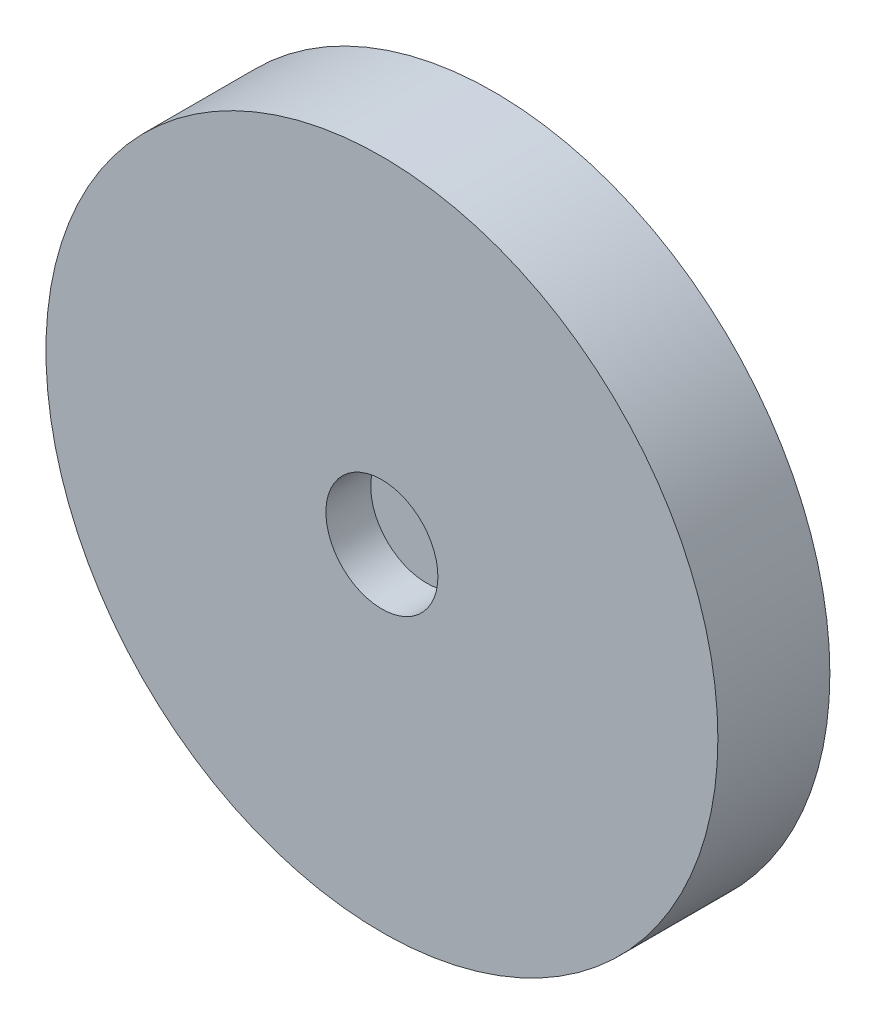
from build123d import *

# Parameters (mm, degrees)
ESQUISSE1_R             = 15
BOSS_EXTRU_1_DEPTH      = 5
ESQUISSE2_R             = 1
BOSS_EXTRU_2_DEPTH      = 3
ESQUISSE3_R             = 2.5
ENL_V_MAT_EXTRU_2_DEPTH = 2


with BuildPart() as part:
    # Esquisse1 → Boss.-Extru.1 (new body)
    with BuildSketch(Plane.XY):
        Circle(ESQUISSE1_R)
    extrude(amount=BOSS_EXTRU_1_DEPTH)

    # Esquisse2 → Boss.-Extru.2 (add)
    with BuildSketch(Plane(origin=(0, 0, 0), x_dir=(-1, 0, 0), z_dir=(0, 0, -1))):
        with Locations(Location((0, 0, 0), (0, 0, 180))):
            Circle(ESQUISSE2_R)
    extrude(amount=BOSS_EXTRU_2_DEPTH)

    # Esquisse3 → Enlèv. mat.-Extru.2 (cut)
    with BuildSketch(Plane.XY.offset(5)):
        Circle(ESQUISSE3_R)
    extrude(amount=-ENL_V_MAT_EXTRU_2_DEPTH, mode=Mode.SUBTRACT)


solid = part.part
